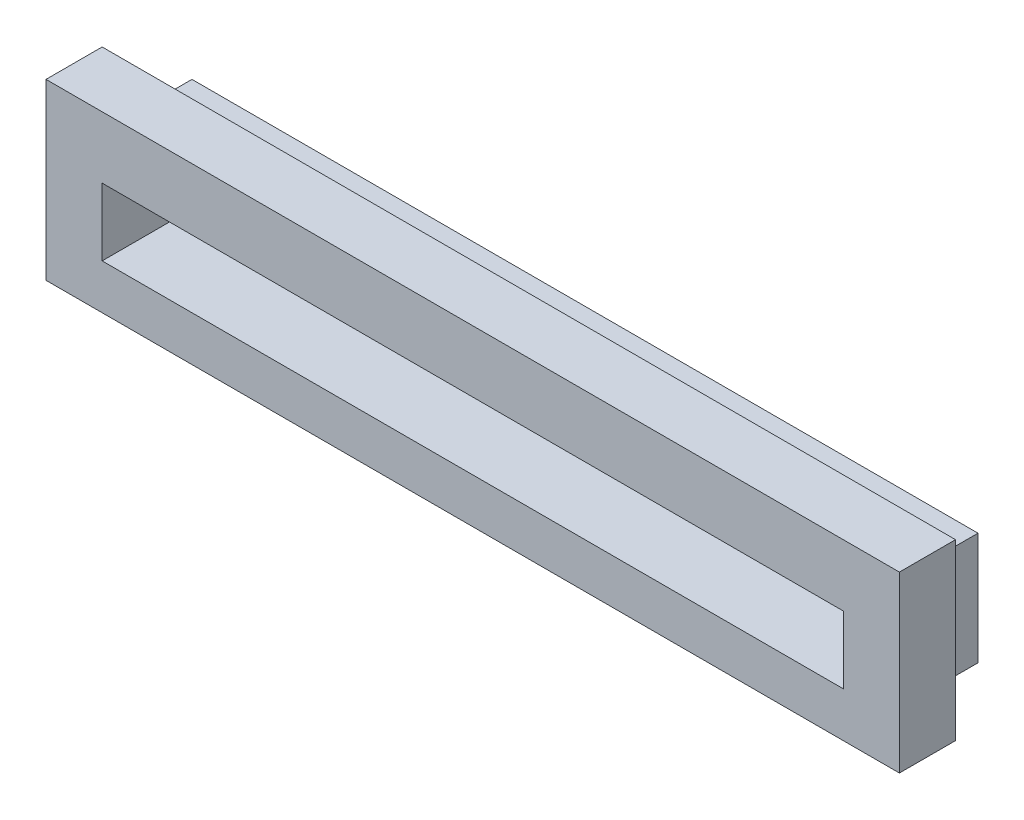
from build123d import *

# Parameters (mm, degrees)
SKETCH1_W           = 177.8
SKETCH1_H           = 25.4
SKETCH1_W_2         = 167.64
SKETCH1_H_2         = 15.24
BOSS_EXTRUDE2_DEPTH = 25.4
SKETCH3_W           = 193.04
SKETCH3_H           = 39.37
SKETCH3_W_2         = 177.8
SKETCH3_H_2         = 25.4
BOSS_EXTRUDE3_DEPTH = 12.7


with BuildPart() as part:
    # Sketch1 → Boss-Extrude2 (new body)
    with BuildSketch(Plane.XY):
        with Locations((88.9, 12.7)):
            Rectangle(SKETCH1_W, SKETCH1_H)
        with Locations((88.9, 12.7)):
            Rectangle(SKETCH1_W_2, SKETCH1_H_2, mode=Mode.SUBTRACT)
    extrude(amount=BOSS_EXTRUDE2_DEPTH)

    # Sketch3 → Boss-Extrude3 (add)
    with BuildSketch(Plane.XY.offset(25.4)):
        with Locations((88.9, 14.605)):
            Rectangle(SKETCH3_W, SKETCH3_H)
        with Locations((88.9, 12.7)):
            Rectangle(SKETCH3_W_2, SKETCH3_H_2, mode=Mode.SUBTRACT)
    extrude(amount=-BOSS_EXTRUDE3_DEPTH)


solid = part.part
